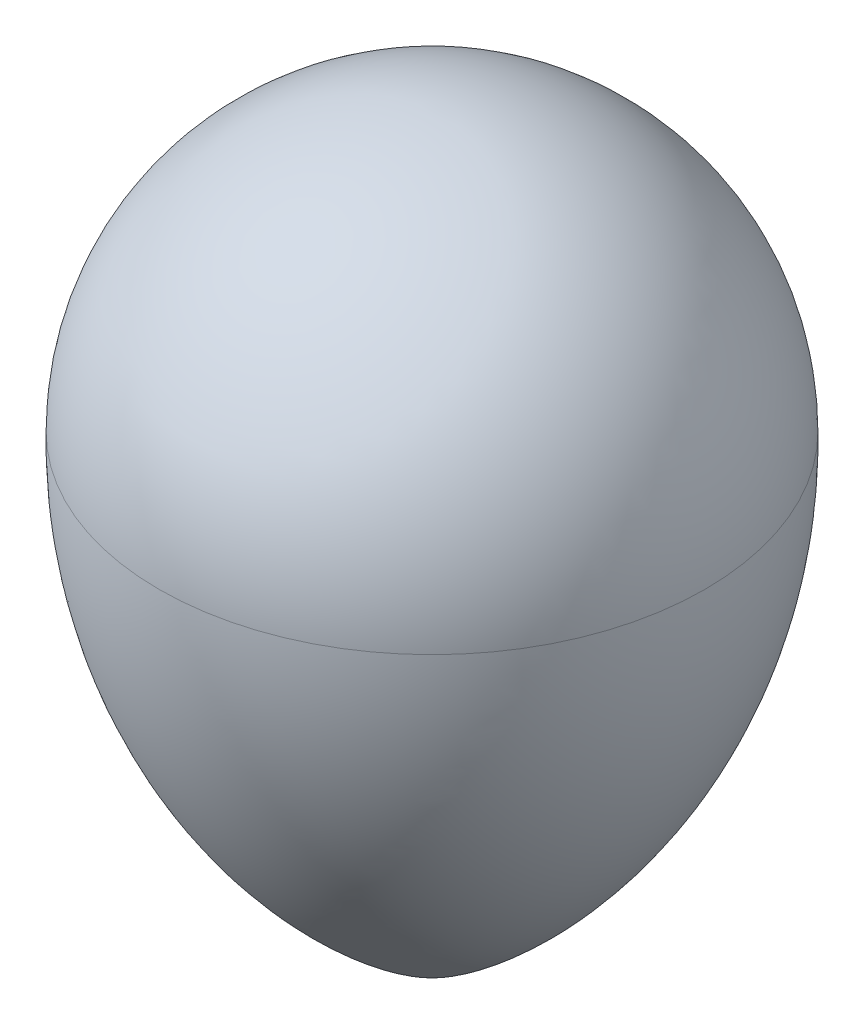
from build123d import *


with BuildPart() as part:
    # Sketch2 → Revolve1 (revolve)
    with BuildSketch(Plane.XY):
        with BuildLine():
            Line((0, 93.452830189), (0, -160.547169811))
            ThreePointArc((0, -160.547169811), (69.004995058, -93.241713541), (93.452830189, 0))
            ThreePointArc((93.452830189, 0), (66.081129947, 66.081129947), (0, 93.452830189))
        make_face()
    revolve(axis=Axis((0, 93.452830189, 0), (0, -1, 0)))


solid = part.part
